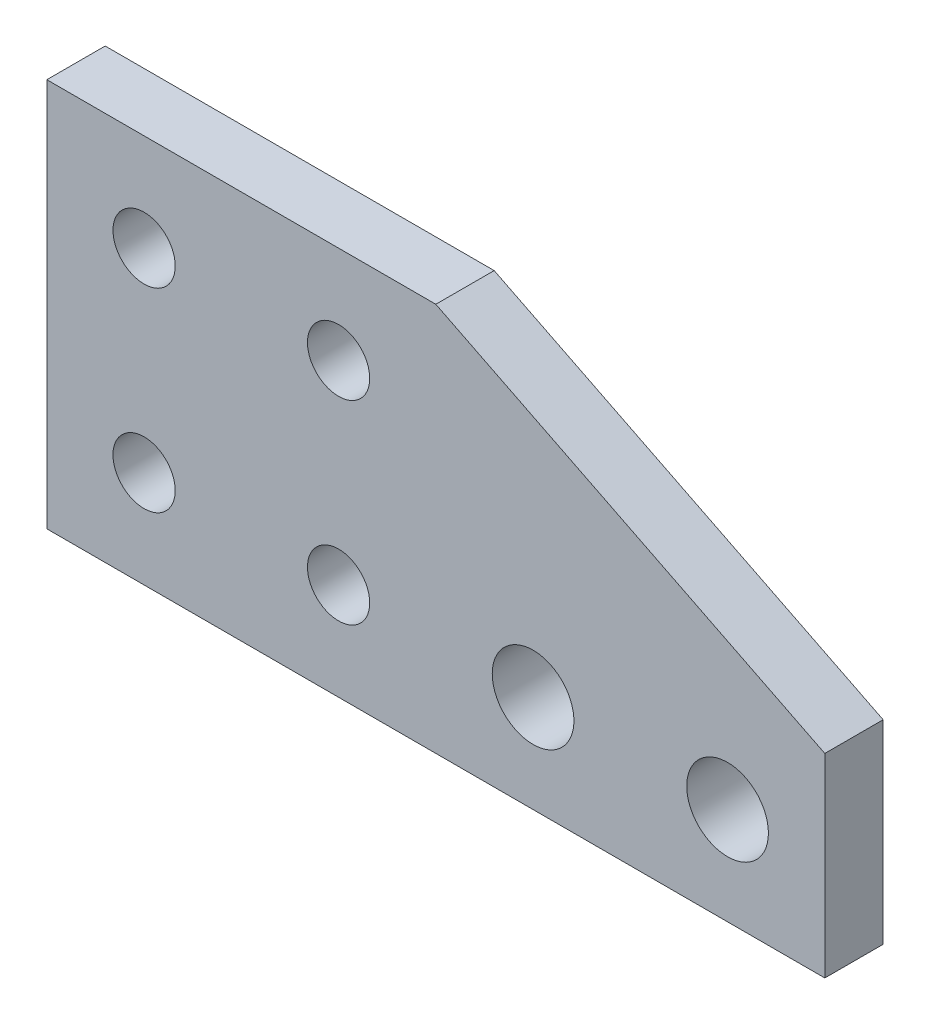
from build123d import *

# Parameters (mm, degrees)
EXTRUDE_1_DEPTH     = 3
SKETCH_2_R          = 1.6
SKETCH_2_R_2        = 2.1
CUT_EXTRUDE_1_DEPTH = 45.821869662
EXTRUDE_2_DEPTH     = 3


with BuildPart() as part:
    # 草图1 → 凸台-拉伸1 (new body)
    with BuildSketch(Plane.XY):
        Polygon((0, 0), (20, 0), (20, -10), (40, -10), (40, -20), (0, -20), align=None)
    extrude(amount=EXTRUDE_1_DEPTH)

    # 草图2 → 切除-拉伸1 (cut, through all)
    with BuildSketch(Plane.XY.offset(3)):
        with Locations((5, -5)):
            Circle(SKETCH_2_R)
        with Locations(Location((5, -15, 0), (0, 0, 180))):
            Circle(SKETCH_2_R)
        with Locations(Location((15, -5, 0), (0, 0, 180))):
            Circle(SKETCH_2_R)
        with Locations((15, -15)):
            Circle(SKETCH_2_R)
        with Locations((35, -15)):
            Circle(SKETCH_2_R_2)
        with Locations(Location((25, -15, 0), (0, 0, 180))):
            Circle(SKETCH_2_R_2)
    extrude(amount=-CUT_EXTRUDE_1_DEPTH, mode=Mode.SUBTRACT)

    # 草图4 → 凸台-拉伸2 (add)
    with BuildSketch(Plane.XY.offset(3)):
        Polygon((20, 0), (40, -10), (20, -10), align=None)
    extrude(amount=-EXTRUDE_2_DEPTH)


solid = part.part
